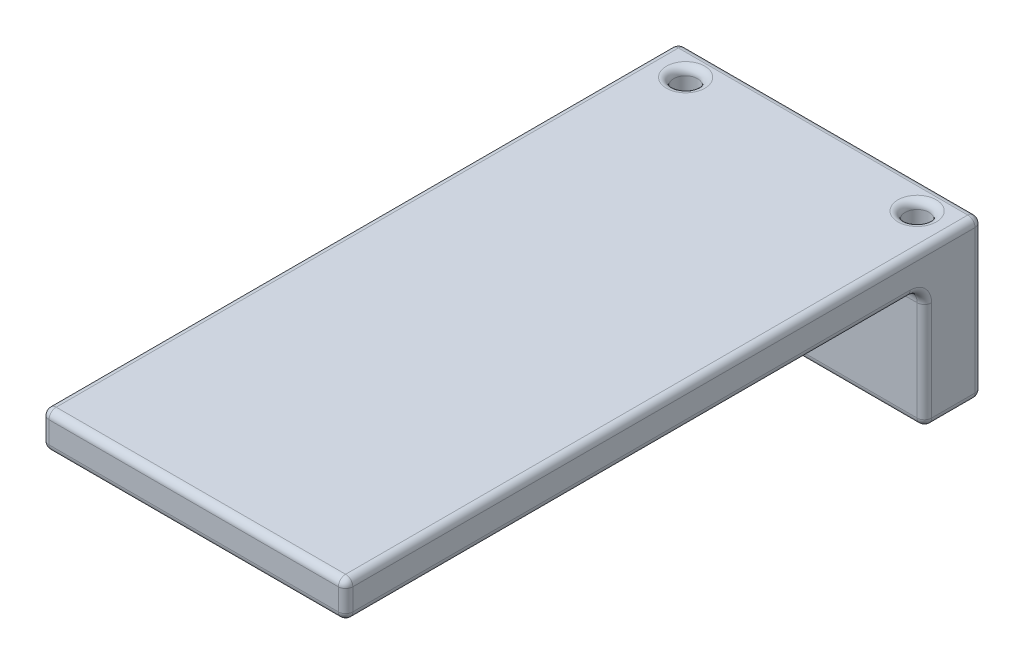
from build123d import *

# Parameters (mm, degrees)
SKETCH1_W           = 42
SKETCH1_H           = 80
BOSS_EXTRUDE1_DEPTH = 5
SKETCH2_W           = 42
SKETCH2_H           = 8
SKETCH2_R           = 1.65
BOSS_EXTRUDE2_DEPTH = 21.8
FILLET1_R           = 2
FILLET2_R           = 1


with BuildPart() as part:
    # Sketch1 → Boss-Extrude1 (new body)
    with BuildSketch(Plane(origin=(0, 0, 0), x_dir=(1, 0, 0), z_dir=(0, 1, 0))):
        Rectangle(SKETCH1_W, SKETCH1_H)
    extrude(amount=BOSS_EXTRUDE1_DEPTH)

    # Sketch2 → Boss-Extrude2 (add)
    with BuildSketch(Plane(origin=(0, 5, 0), x_dir=(1, 0, 0), z_dir=(0, 1, 0))):
        with Locations((0, 44)):
            Rectangle(SKETCH2_W, SKETCH2_H)
        with Locations(Location((16, 44, 0), (0, 0, 270))):
            Circle(SKETCH2_R, mode=Mode.SUBTRACT)
        with Locations(Location((-16, 44, 0), (0, 0, 270))):
            Circle(SKETCH2_R, mode=Mode.SUBTRACT)
    extrude(amount=-BOSS_EXTRUDE2_DEPTH)

    # Fillet1
    fillet1_edges = [part.edges().sort_by_distance(p)[0] for p in [
        (0, 0, -40),
    ]]
    fillet(fillet1_edges, radius=FILLET1_R)

    # Fillet2
    fillet2_edges = [part.edges().sort_by_distance(p)[0] for p in [
        (-21, 5, -4),
        (21, -9.4, -40),
        (21, -5.9, -48),
        (-21, -5.9, -48),
        (-21, -9.4, -40),
        (16, -16.8, -45.65),
        (16, 5, -45.65),
        (0, 5, -48),
        (0, 5, 40),
        (-16, -16.8, -45.65),
        (-16, 5, -45.65),
        (-21, -16.8, -44),
        (0, -16.8, -48),
        (21, -16.8, -44),
        (0, -16.8, -40),
        (-21, 0, 1),
        (-21, -0.585786438, -39.414213562),
        (21, -0.585786438, -39.414213562),
        (21, 5, -4),
        (0, 0, 40),
        (21, 0, 1),
        (21, 2.5, 40),
        (-21, 2.5, 40),
    ]]
    fillet(fillet2_edges, radius=FILLET2_R)


solid = part.part
